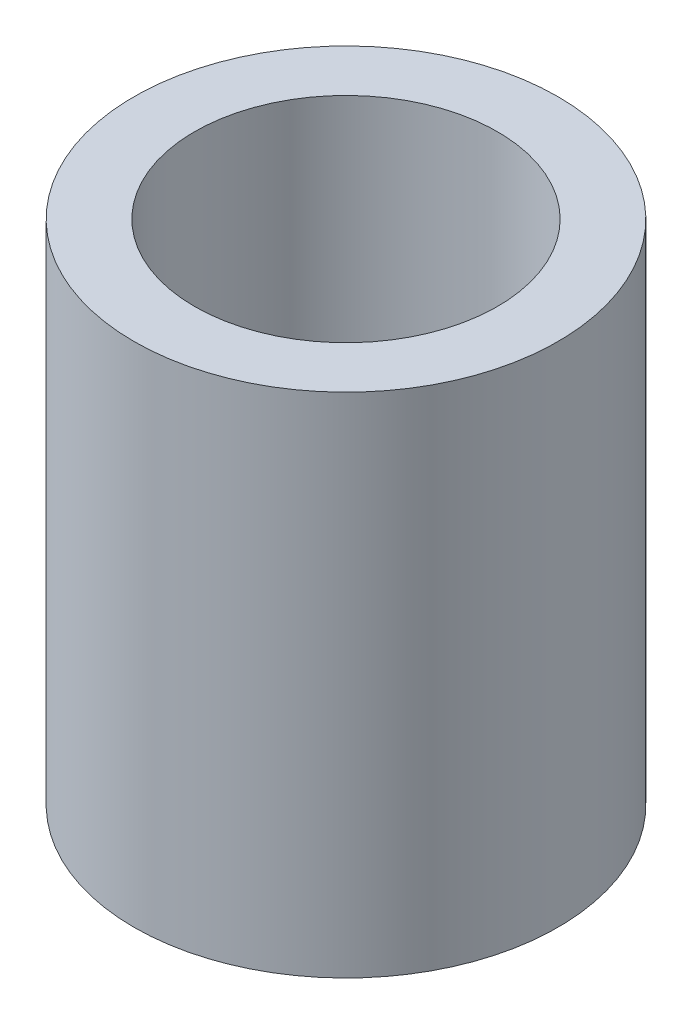
from build123d import *

# Parameters (mm, degrees)
CROQUIS1_R              = 14
CROQUIS1_R_2            = 10
SALIENTE_EXTRUIR1_DEPTH = 16.75


with BuildPart() as part:
    # Croquis1 → Saliente-Extruir1 (new, symmetric)
    with BuildSketch(Plane(origin=(0, 0, 0), x_dir=(1, 0, 0), z_dir=(0, 1, 0))):
        with Locations(Location((0, 0, 0), (0, 0, 270))):
            Circle(CROQUIS1_R)
        with Locations(Location((0, 0, 0), (0, 0, 270))):
            Circle(CROQUIS1_R_2, mode=Mode.SUBTRACT)
    extrude(amount=SALIENTE_EXTRUIR1_DEPTH, both=True)


solid = part.part
